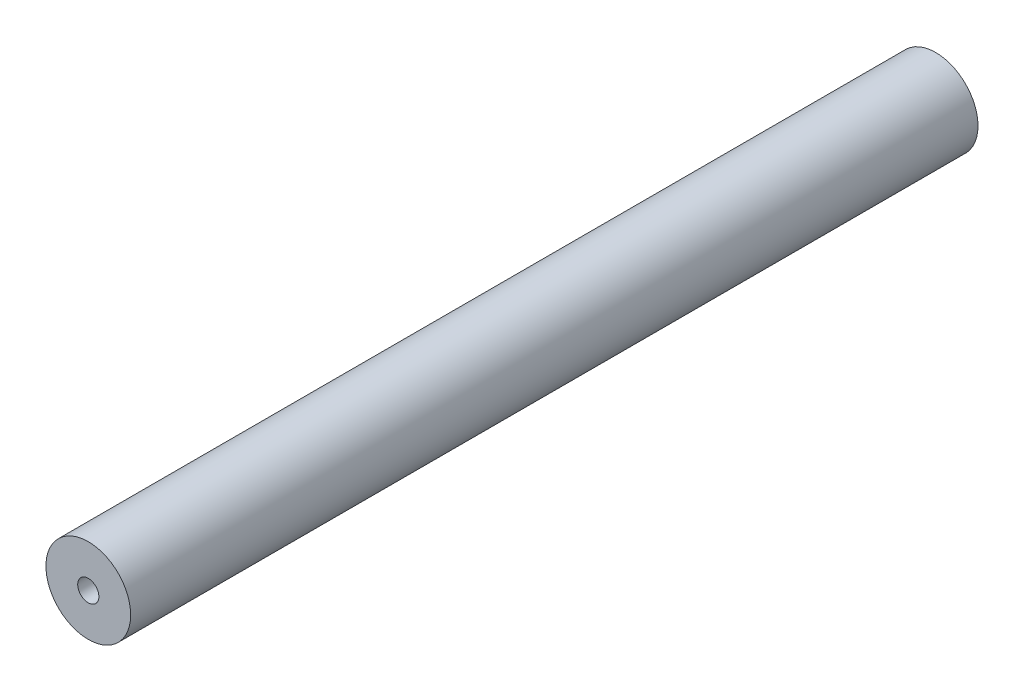
from build123d import *

# Parameters (mm, degrees)
SKETCH1_R           = 25.4
SKETCH1_R_2         = 6.35
BOSS_EXTRUDE1_DEPTH = 508


with BuildPart() as part:
    # Sketch1 → Boss-Extrude1 (new body)
    with BuildSketch(Plane.XY):
        Circle(SKETCH1_R)
        Circle(SKETCH1_R_2, mode=Mode.SUBTRACT)
    extrude(amount=BOSS_EXTRUDE1_DEPTH)


solid = part.part
